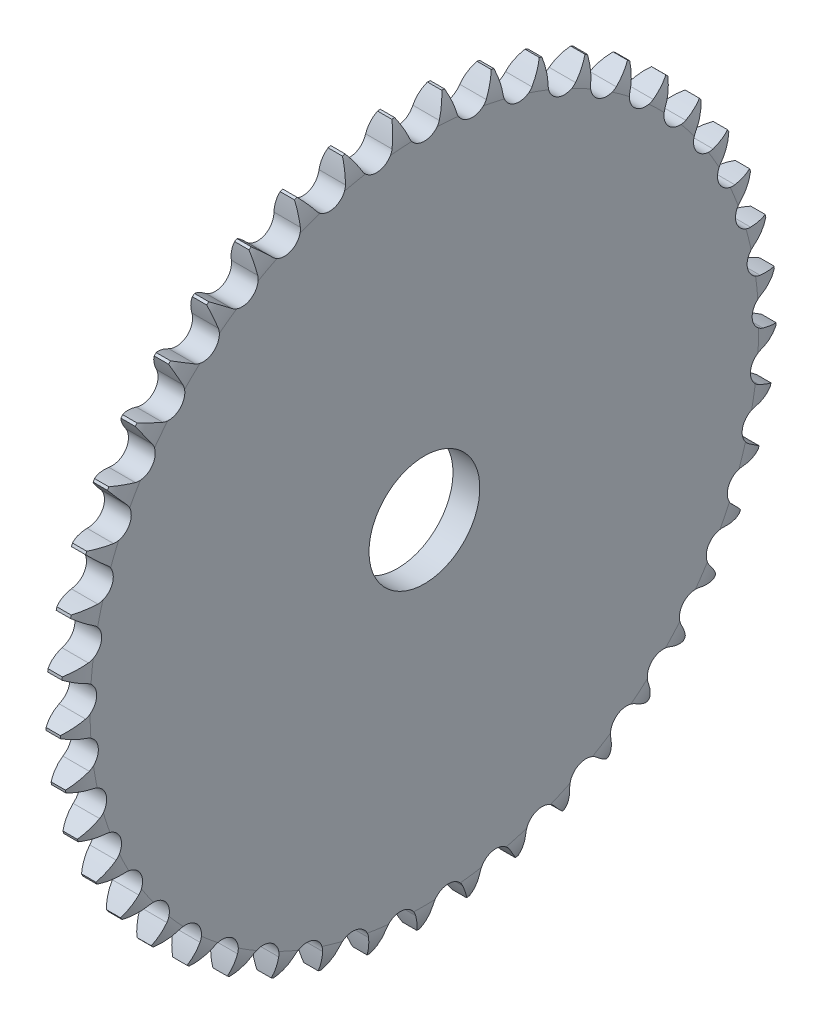
from build123d import *

# Parameters (mm, degrees)
TOOTHCUT_DEPTH  = 101.622508287
TEETHCUTS_COUNT = 45
TEETHCUTS_ANGLE = 352
BORSKE_R        = 11
BORE_DEPTH      = 50.0005


with BuildPart() as part:
    # BasProSke → Base-Revolve (revolve)
    with BuildSketch(Plane(origin=(0, 0, 0), x_dir=(1, 0, 0), z_dir=(0, 1, 0)), mode=Mode.PRIVATE) as base_revolve_sk:
        with BuildLine():
            Line((0, 0), (0, 66.355481801))
            ThreePointArc((0, 66.355481801), (0.314698702, 68.783644687), (1.238, 71.05135829))
            Line((1.238, 71.05135829), (4.0816, 71.05135829))
            ThreePointArc((4.0816, 71.05135829), (5.004901298, 68.783644687), (5.3196, 66.355481801))
            Line((5.3196, 66.355481801), (5.3196, 0))
            Line((5.3196, 0), (0, 0))
        make_face()
    revolve(base_revolve_sk.sketch.rotate(Axis((-10, 0, 0), (1, 0, 0)), 180), axis=Axis((-10, 0, 0), (1, 0, 0)))

    # TooCutSke → ToothCut (cut, through all)
    with BuildSketch(Plane(origin=(0, 0, 0), x_dir=(0, 0, -1), z_dir=(1, 0, 0))):
        with BuildLine():
            ThreePointArc((2.993759033, 67.155786868), (3.897753615, 69.299850477), (4.939067203, 71.380687082))
            ThreePointArc((4.939067203, 71.380687082), (0, 71.55135829), (-4.939067203, 71.380687082))
            ThreePointArc((-4.939067203, 71.380687082), (-3.897753615, 69.299850477), (-2.993759033, 67.155786868))
            ThreePointArc((-2.993759033, 67.155786868), (0, 65.09823329), (2.993759033, 67.155786868))
        make_face()
    toothcut = extrude(amount=TOOTHCUT_DEPTH, mode=Mode.SUBTRACT)

    # TeethCuts: ToothCut ×45 about axis
    teethcuts_axis = Axis((-10, 0, 0), (1, 0, 0))
    for i in range(1, TEETHCUTS_COUNT):
        add(toothcut.rotate(teethcuts_axis, i * TEETHCUTS_ANGLE / (TEETHCUTS_COUNT - 1)), mode=Mode.SUBTRACT)

    # BorSke → Bore (cut, symmetric)
    with BuildSketch(Plane(origin=(0, 0, 0), x_dir=(0, 0, -1), z_dir=(1, 0, 0))):
        with Locations(Location((0, 0, 0), (0, 0, 180))):
            Circle(BORSKE_R)
    extrude(amount=BORE_DEPTH, both=True, mode=Mode.SUBTRACT)


solid = part.part
